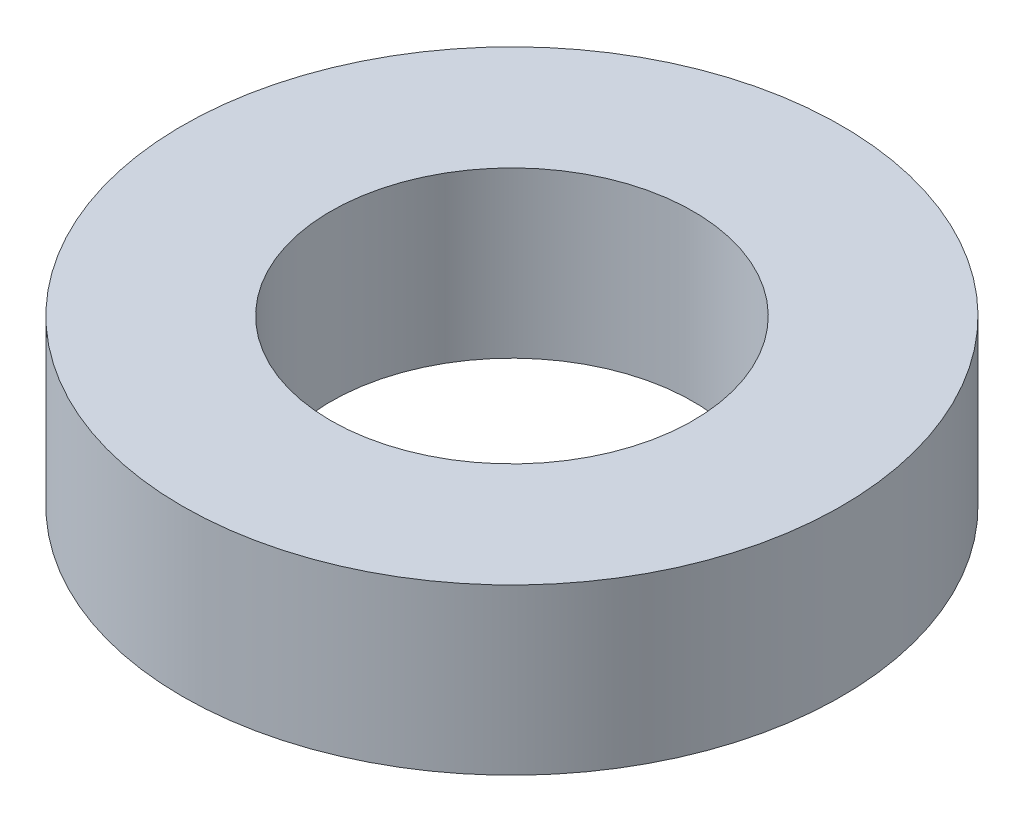
from build123d import *

# Parameters (mm, degrees)
SKETCH1_R           = 2
SKETCH1_R_2         = 1.1
BOSS_EXTRUDE1_DEPTH = 0.5


with BuildPart() as part:
    # Sketch1 → Boss-Extrude1 (new, symmetric)
    with BuildSketch(Plane(origin=(0, 0, 0), x_dir=(1, 0, 0), z_dir=(0, 1, 0))):
        with Locations(Location((0, 0, 0), (0, 0, 270))):
            Circle(SKETCH1_R)
        with Locations(Location((0, 0, 0), (0, 0, 270))):
            Circle(SKETCH1_R_2, mode=Mode.SUBTRACT)
    extrude(amount=BOSS_EXTRUDE1_DEPTH, both=True)


solid = part.part
